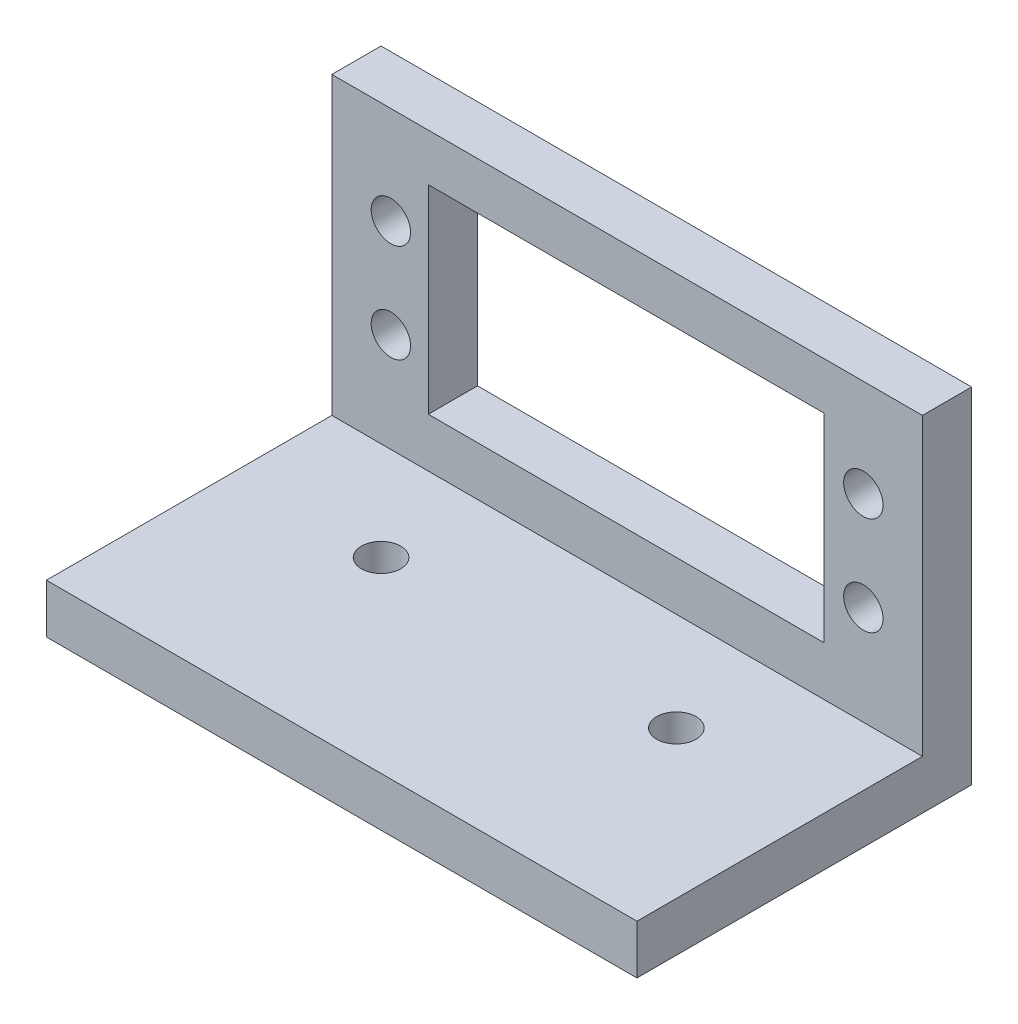
from build123d import *

# Parameters (mm, degrees)
SKETCH1_W           = 60
SKETCH1_H           = 35
SKETCH1_W_2         = 40.2
SKETCH1_H_2         = 20.2
BOSS_EXTRUDE1_DEPTH = 5
SKETCH2_W           = 60
SKETCH2_H           = 5
BOSS_EXTRUDE2_DEPTH = 29
SKETCH3_R           = 2
CUT_EXTRUDE1_DEPTH  = 10
SKETCH4_R           = 2
CUT_EXTRUDE2_DEPTH  = 48.451090489


with BuildPart() as part:
    # Sketch1 → Boss-Extrude1 (new body)
    with BuildSketch(Plane.XY):
        with Locations((-2.1, -1.998615043)):
            Rectangle(SKETCH1_W, SKETCH1_H)
        with Locations((-2.2, 0.601384957)):
            Rectangle(SKETCH1_W_2, SKETCH1_H_2, mode=Mode.SUBTRACT)
    extrude(amount=BOSS_EXTRUDE1_DEPTH)

    # Sketch2 → Boss-Extrude2 (add)
    with BuildSketch(Plane.XY.offset(5)):
        with Locations((-2.1, -16.998615043)):
            Rectangle(SKETCH2_W, SKETCH2_H)
    extrude(amount=BOSS_EXTRUDE2_DEPTH)

    # Sketch3 → Cut-Extrude1 (cut)
    with BuildSketch(Plane(origin=(0, -19.498615043, 0), x_dir=(-1, 0, 0), z_dir=(0, -1, 0))):
        with Locations(Location((17.1, -15, 0), (0, 0, 90))):
            Circle(SKETCH3_R)
        with Locations(Location((-12.9, -15, 0), (0, 0, 90))):
            Circle(SKETCH3_R)
    extrude(amount=-CUT_EXTRUDE1_DEPTH, mode=Mode.SUBTRACT)

    # Sketch4 → Cut-Extrude2 (cut, through all)
    with BuildSketch(Plane.XY.offset(5)):
        with Locations((21.9, 5.601384957)):
            Circle(SKETCH4_R)
        with Locations((21.9, -4.398615043)):
            Circle(SKETCH4_R)
        with Locations((-26.1, -4.398615043)):
            Circle(SKETCH4_R)
        with Locations((-26.1, 5.601384957)):
            Circle(SKETCH4_R)
    extrude(amount=-CUT_EXTRUDE2_DEPTH, mode=Mode.SUBTRACT)


solid = part.part
